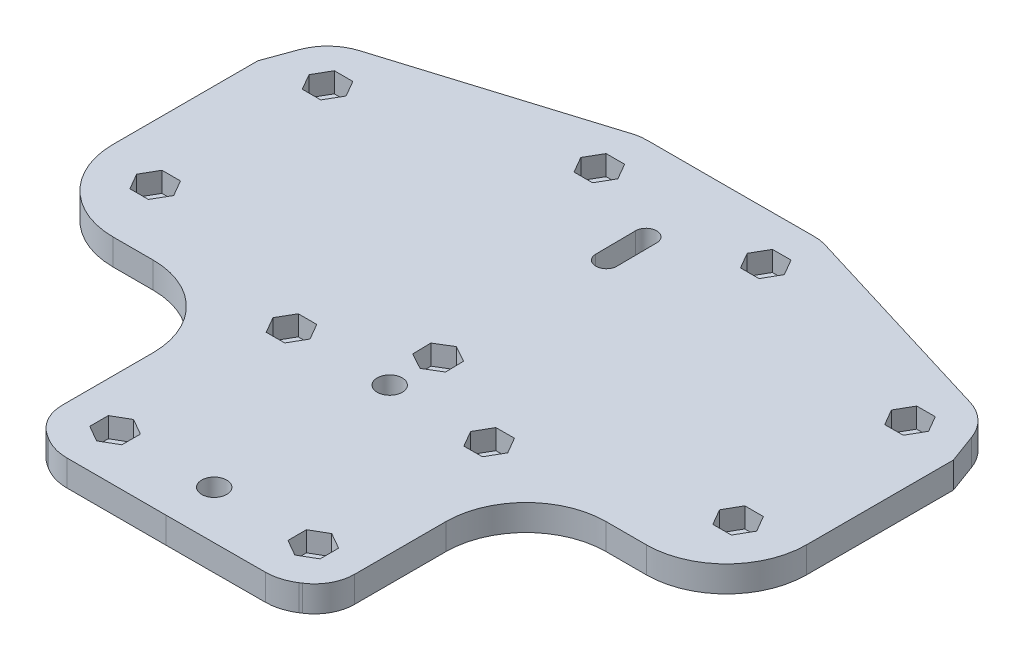
from build123d import *

# Parameters (mm, degrees)
SKETCH2_R          = 2.625
SKETCH2_R_2        = 3.125
MAINPLATE_DEPTH    = 6.5
PRESSFITNUTS_DEPTH = 5
CUT_EXTRUDE2_DEPTH = 6.5
FILLET2_R          = 10


with BuildPart() as part:
    # Sketch2 → MainPlate (new body)
    with BuildSketch(Plane(origin=(0, 0, 0), x_dir=(1, 0, 0), z_dir=(0, 1, 0))):
        with BuildLine():
            Line((24.899900609, -92.429929219), (0.2, -92.5))
            Line((0.2, -92.5), (-24.5, -92.5))
            ThreePointArc((-24.5, -92.5), (-27.871368271, -92.016678166), (-30.971160559, -90.605645997))
            Line((-30.971160559, -90.605645997), (-99.683475736, -46.605645997))
            ThreePointArc((-99.683475736, -46.605645997), (-104.578950448, -40.347025165), (-104.490786491, -32.401697323))
            Line((-104.490786491, -32.401697323), (-83.778471314, 24.598302677))
            ThreePointArc((-83.778471314, 24.598302677), (-80.773721892, 29.191692934), (-76.037940173, 31.966602781))
            Line((-76.037940173, 31.966602781), (-24.911380811, 47.741345462))
            ThreePointArc((-24.911380811, 47.741345462), (-22.845839779, 48.308813352), (-20.712315177, 48.5))
            Line((-20.712315177, 48.5), (0, 48.5))
            Line((0, 48.5), (20.712231832, 48.558758223))
            ThreePointArc((20.712231832, 48.558758223), (22.846290221, 48.373624884), (24.913432777, 47.812018957))
            Line((24.913432777, 47.812018957), (76.084537362, 32.182379345))
            ThreePointArc((76.084537362, 32.182379345), (80.828172093, 29.420915478), (83.845940292, 24.836067799))
            Line((83.845940292, 24.836067799), (104.719873926, -32.104944614))
            ThreePointArc((104.719873926, -32.104944614), (104.830577421, -40.049990373), (99.952877324, -46.322473865))
            Line((99.952877324, -46.322473865), (31.365661085, -90.517224974))
            ThreePointArc((31.365661085, -90.517224974), (28.26988419, -91.937045184), (24.899900609, -92.429929219))
        make_face()
        with Locations(Location((-72.5, 20.5, 0), (0, 0, 90))):
            Circle(SKETCH2_R, mode=Mode.SUBTRACT)
        with Locations(Location((-20.712315177, 36.5, 0), (0, 0, 90))):
            Circle(SKETCH2_R, mode=Mode.SUBTRACT)
        with Locations(Location((-93.212315177, -36.5, 0), (0, 0, 90))):
            Circle(SKETCH2_R, mode=Mode.SUBTRACT)
        with Locations(Location((-58.856157589, -58.5, 0), (0, 0, 90))):
            Circle(SKETCH2_R, mode=Mode.SUBTRACT)
        with Locations(Location((-24.5, -80.5, 0), (0, 0, 90))):
            Circle(SKETCH2_R, mode=Mode.SUBTRACT)
        with Locations(Location((-24.5, -36.5, 0), (0, 0, 90))):
            Circle(SKETCH2_R, mode=Mode.SUBTRACT)
        with Locations(Location((-72.5, -22.5, 0), (0, 0, 90))):
            Circle(SKETCH2_R, mode=Mode.SUBTRACT)
        with Locations(Location((24.74103568, -36.430154559, 0), (0, 0, 90))):
            Circle(SKETCH2_R, mode=Mode.SUBTRACT)
        with Locations(Location((24.865858124, -80.429977506, 0), (0, 0, 90))):
            Circle(SKETCH2_R, mode=Mode.SUBTRACT)
        with Locations(Location((59.159466244, -58.332601952, 0), (0, 0, 90))):
            Circle(SKETCH2_R, mode=Mode.SUBTRACT)
        with Locations(Location((93.453074364, -36.235226398, 0), (0, 0, 90))):
            Circle(SKETCH2_R, mode=Mode.SUBTRACT)
        with Locations(Location((72.701126299, -22.294040956, 0), (0, 0, 90))):
            Circle(SKETCH2_R, mode=Mode.SUBTRACT)
        with Locations(Location((72.579140729, 20.705786015, 0), (0, 0, 90))):
            Circle(SKETCH2_R, mode=Mode.SUBTRACT)
        with Locations(Location((20.746274317, 36.55880651, 0), (0, 0, 90))):
            Circle(SKETCH2_R, mode=Mode.SUBTRACT)
        with Locations(Location((0, -36.5, 0), (0, 0, 90))):
            Circle(SKETCH2_R_2, mode=Mode.SUBTRACT)
        with Locations(Location((0.182929062, -80.464988753, 0), (0, 0, 90))):
            Circle(SKETCH2_R_2, mode=Mode.SUBTRACT)
        with Locations(Location((0.103546099, -24.5, 0), (0, 0, 90))):
            Circle(SKETCH2_R, mode=Mode.SUBTRACT)
        with BuildLine():
            Line((2.580926866, 27.523084214), (2.668870128, 17.523084214))
            ThreePointArc((2.668870128, 17.523084214), (0.067055845, 14.875101503), (-2.580926866, 17.476915786))
            Line((-2.580926866, 17.476915786), (-2.668870128, 27.476915786))
            ThreePointArc((-2.668870128, 27.476915786), (-0.067055845, 30.124898497), (2.580926866, 27.523084214))
        make_face(mode=Mode.SUBTRACT)
    extrude(amount=MAINPLATE_DEPTH)

    # Sketch8 → PressFitNuts (cut)
    with BuildSketch(Plane(origin=(0, 6.5, 0), x_dir=(1, 0, 0), z_dir=(0, 1, 0))):
        Polygon((-3.847658971, -26.891926384), (0.199412577, -29.117807158), (4.150617647, -26.725880774), (4.054751169, -22.108073616), (0.007679621, -19.882192842), (-3.943525449, -22.274119226), align=None)
        Polygon((-19.881197846, -36.5), (-22.190598923, -32.5), (-26.809401077, -32.5), (-29.118802154, -36.5), (-26.809401077, -40.5), (-22.190598923, -40.5), align=None)
        Polygon((-67.881197846, -22.5), (-70.190598923, -18.5), (-74.809401077, -18.5), (-77.118802154, -22.5), (-74.809401077, -26.5), (-70.190598923, -26.5), align=None)
        Polygon((-67.881197846, 20.5), (-70.190598923, 24.5), (-74.809401077, 24.5), (-77.118802154, 20.5), (-74.809401077, 16.5), (-70.190598923, 16.5), align=None)
        Polygon((-88.593513024, -36.5), (-90.9029141, -32.5), (-95.521716254, -32.5), (-97.831117331, -36.5), (-95.521716254, -40.5), (-90.9029141, -40.5), align=None)
        Polygon((-54.237355435, -58.5), (-56.546756512, -54.5), (-61.165558665, -54.5), (-63.474959742, -58.5), (-61.165558665, -62.5), (-56.546756512, -62.5), align=None)
        Polygon((-24.5, -75.881197846), (-28.5, -78.190598923), (-28.5, -82.809401077), (-24.5, -85.118802154), (-20.5, -82.809401077), (-20.5, -78.190598923), align=None)
        Polygon((-16.093513024, 36.5), (-18.4029141, 40.5), (-23.021716254, 40.5), (-25.331117331, 36.5), (-23.021716254, 32.5), (-18.4029141, 32.5), align=None)
        Polygon((18.448230028, 32.552271126), (16.127490749, 36.545703551), (18.425535038, 40.552238935), (23.044318606, 40.565341893), (25.365057885, 36.571909468), (23.067013596, 32.565374085), align=None)
        Polygon((20.859322741, -78.131933217), (24.852755166, -75.811193938), (28.859290549, -78.109238227), (28.872393508, -82.728021795), (24.878961083, -85.048761074), (20.872425699, -82.750716785), align=None)
        Polygon((56.861421955, -62.339137336), (54.540682676, -58.34570491), (56.838726965, -54.339169527), (61.457510533, -54.326066569), (63.778249812, -58.319498994), (61.480205523, -62.326034377), align=None)
        Polygon((91.155030075, -40.241761781), (88.834290796, -36.248329356), (91.132335085, -32.241793973), (95.751118653, -32.228691014), (98.071857931, -36.222123439), (95.773813642, -40.228658823), align=None)
        Polygon((70.28109644, 16.699250632), (67.960357161, 20.692683057), (70.25840145, 24.69921844), (74.877185018, 24.712321399), (77.197924297, 20.718888974), (74.899880008, 16.71235359), align=None)
        Polygon((70.40308201, -26.300576339), (68.082342731, -22.307143914), (70.38038702, -18.300608531), (74.999170588, -18.287505572), (77.319909867, -22.280937997), (75.021865578, -26.287473381), align=None)
        Polygon((22.442991391, -40.436689943), (20.122252112, -36.443257518), (22.420296401, -32.436722134), (27.039079969, -32.423619176), (29.359819248, -36.417051601), (27.061774959, -40.423586984), align=None)
    extrude(amount=-PRESSFITNUTS_DEPTH, mode=Mode.SUBTRACT)

    # Sketch11 → Cut-Extrude2 (cut)
    with BuildSketch(Plane(origin=(0, 0, 0), x_dir=(1, 0, 0), z_dir=(0, 1, 0))):
        with BuildLine():
            Line((-111.9, 4.5), (-111.9, -116.15))
            Line((-111.9, -116.15), (-86.5, -116.15))
            Line((-86.5, -116.15), (-36.5, -116.15))
            Line((-36.5, -116.15), (-36.5, -59))
            ThreePointArc((-36.5, -59), (-42.357864376, -44.857864376), (-56.5, -39))
            Line((-56.5, -39), (-66.5, -39))
            ThreePointArc((-66.5, -39), (-80.642135624, -33.142135624), (-86.5, -19))
            Line((-86.5, -19), (-86.5, 4.5))
            Line((-86.5, 4.5), (-86.5, 44.576396133))
            Line((-86.5, 44.576396133), (-111.9, 44.576396133))
            Line((-111.9, 44.576396133), (-111.9, 4.5))
        make_face()
        with BuildLine():
            Line((86.5, 4.5), (86.5, 44.576396133))
            Line((86.5, 44.576396133), (111.9, 44.576396133))
            Line((111.9, 44.576396133), (111.9, 4.5))
            Line((111.9, 4.5), (111.9, -116.15))
            Line((111.9, -116.15), (86.5, -116.15))
            Line((86.5, -116.15), (36.5, -116.15))
            Line((36.5, -116.15), (36.5, -59))
            ThreePointArc((36.5, -59), (42.357864376, -44.857864376), (56.5, -39))
            Line((56.5, -39), (66.5, -39))
            ThreePointArc((66.5, -39), (80.642135624, -33.142135624), (86.5, -19))
            Line((86.5, -19), (86.5, 4.5))
        make_face()
    extrude(amount=CUT_EXTRUDE2_DEPTH, mode=Mode.SUBTRACT)

    # Fillet2
    fillet2_edges = [part.edges().sort_by_distance(p)[0] for p in [
        (36.5, 3.25, 87.208870401),
        (-36.5, 3.25, 87.065248111),
    ]]
    fillet(fillet2_edges, radius=FILLET2_R)


solid = part.part
